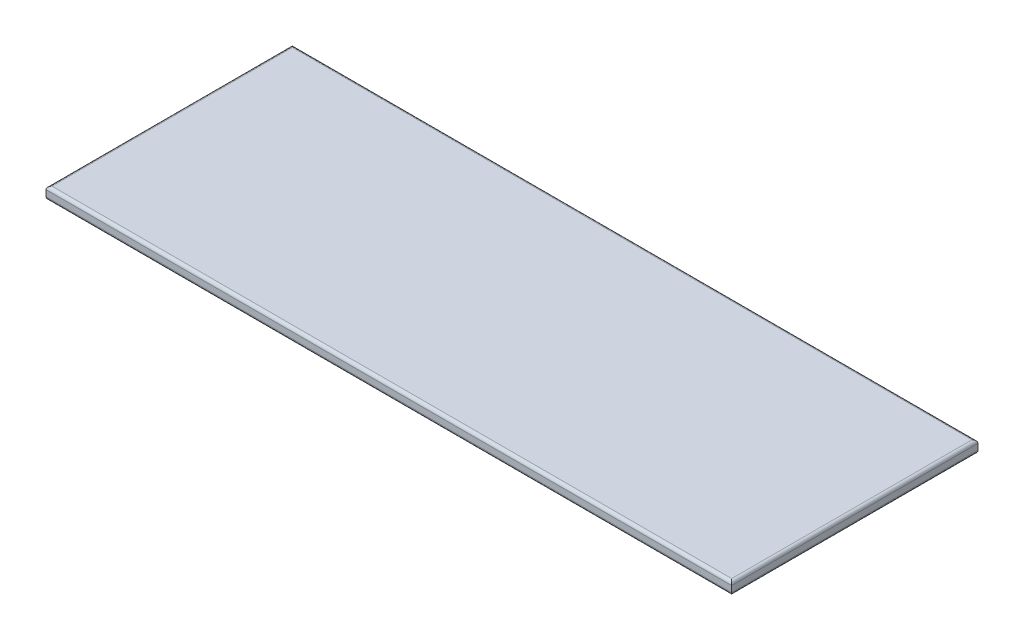
from build123d import *

# Parameters (mm, degrees)
SKETCH1_W           = 113
SKETCH1_H           = 40.6
BOSS_EXTRUDE1_DEPTH = 2
FILLET1_R           = 0.5


with BuildPart() as part:
    # Sketch1 → Boss-Extrude1 (new body)
    with BuildSketch(Plane(origin=(0, 0, 0), x_dir=(1, 0, 0), z_dir=(0, 1, 0))):
        with Locations((56.5, 20.3)):
            Rectangle(SKETCH1_W, SKETCH1_H)
    extrude(amount=BOSS_EXTRUDE1_DEPTH)

    # Fillet1
    fillet1_edges = [part.edges().sort_by_distance(p)[0] for p in [
        (113, 2, -20.3),
        (56.5, 2, -40.6),
        (0, 2, -20.3),
        (56.5, 0, -40.6),
        (113, 0, -20.3),
        (56.5, 0, 0),
        (0, 0, -20.3),
        (56.5, 2, 0),
    ]]
    fillet(fillet1_edges, radius=FILLET1_R)


solid = part.part
